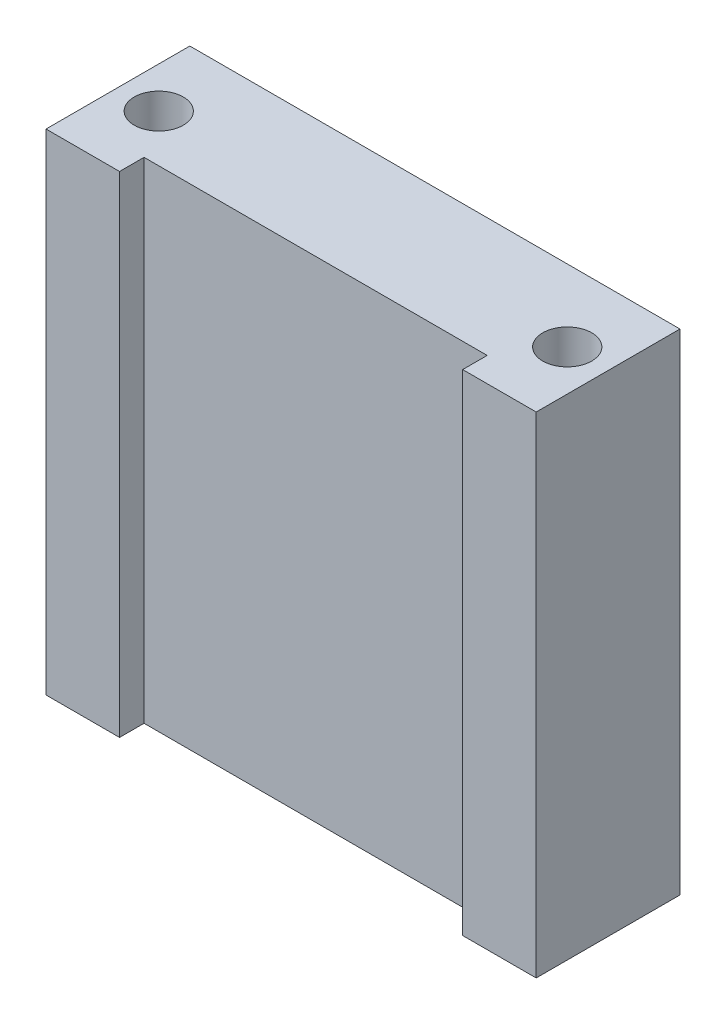
from build123d import *

# Parameters (mm, degrees)
CROQUIS1_R              = 1.5
SALIENTE_EXTRUIR1_DEPTH = 30


with BuildPart() as part:
    # Croquis1 → Saliente-Extruir1 (new body)
    with BuildSketch(Plane(origin=(0, 0, 0), x_dir=(1, 0, 0), z_dir=(0, 1, 0))):
        Polygon((-15, 4.4), (-15, -4.4), (-10.5, -4.4), (-10.5, -2.9), (10.5, -2.9), (10.5, -4.4), (15, -4.4), (15, 4.4), align=None)
        with Locations(Location((-12.5, 0, 0), (0, 0, 270))):
            Circle(CROQUIS1_R, mode=Mode.SUBTRACT)
        with Locations(Location((12.5, 0, 0), (0, 0, 270))):
            Circle(CROQUIS1_R, mode=Mode.SUBTRACT)
    extrude(amount=SALIENTE_EXTRUIR1_DEPTH)


solid = part.part
